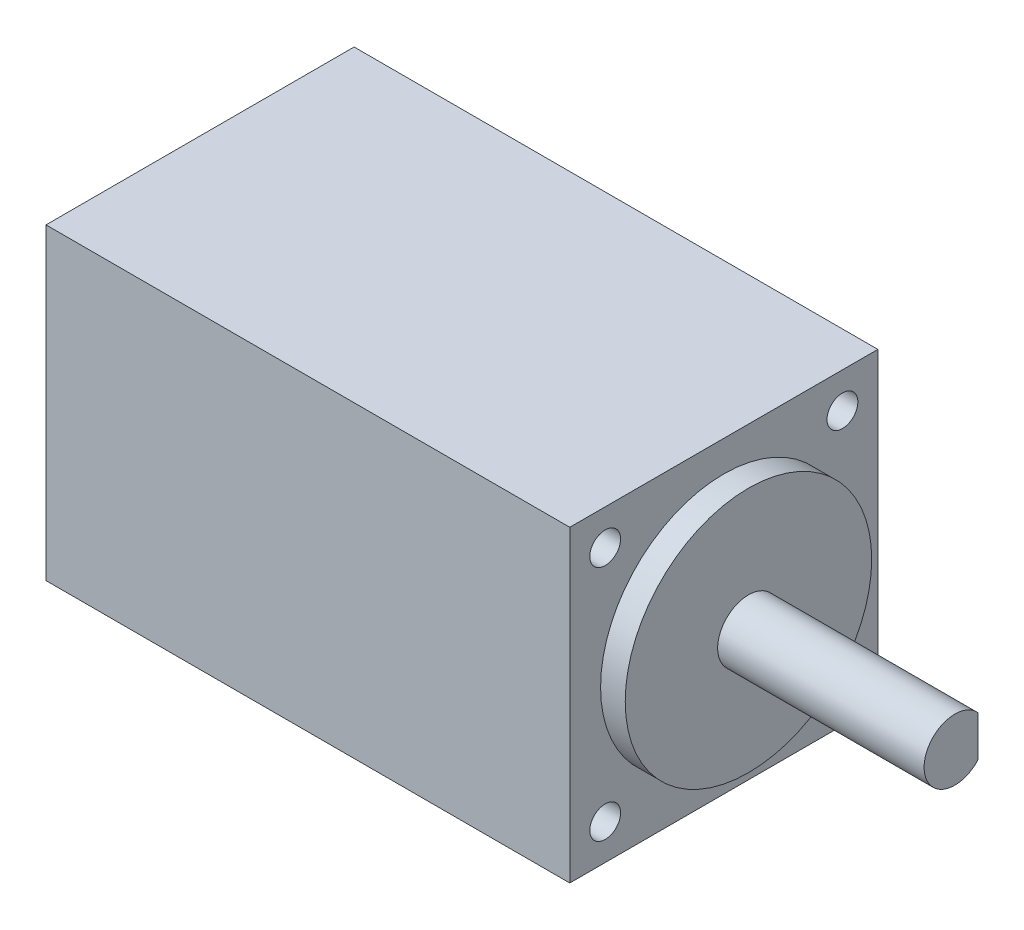
from build123d import *

# Parameters (mm, degrees)
SKETCH_1_W          = 20
SKETCH_1_H          = 20
SKETCH_1_R          = 1
EXTRUDE_2_DEPTH     = 34
SKETCH_2_R          = 8
EXTRUDE_3_DEPTH     = 1.6
SKETCH_3_R          = 2
EXTRUDE_4_DEPTH     = 13.4
CUT_EXTRUDE_START   = -9
CUT_EXTRUDE_1_DEPTH = 9


with BuildPart() as part:
    # 草图1 → 凸台-拉伸2 (new body)
    with BuildSketch(Plane(origin=(0, 0, 0), x_dir=(0, 0, -1), z_dir=(1, 0, 0))):
        with Locations((10, 10)):
            Rectangle(SKETCH_1_W, SKETCH_1_H)
        with Locations((2.3, 2.3)):
            Circle(SKETCH_1_R, mode=Mode.SUBTRACT)
        with Locations((2.3, 17.7)):
            Circle(SKETCH_1_R, mode=Mode.SUBTRACT)
        with Locations((17.7, 17.7)):
            Circle(SKETCH_1_R, mode=Mode.SUBTRACT)
        with Locations((17.7, 2.298566716)):
            Circle(SKETCH_1_R, mode=Mode.SUBTRACT)
    extrude(amount=EXTRUDE_2_DEPTH)

    # 草图2 → 凸台-拉伸3 (add)
    with BuildSketch(Plane(origin=(34, 0, 0), x_dir=(0, 0, -1), z_dir=(1, 0, 0))):
        with Locations((10, 10)):
            Circle(SKETCH_2_R)
    extrude(amount=EXTRUDE_3_DEPTH)

    # 草图3 → 凸台-拉伸4 (add)
    with BuildSketch(Plane(origin=(35.6, 0, 0), x_dir=(0, 0, -1), z_dir=(1, 0, 0))):
        with Locations((10, 10)):
            Circle(SKETCH_3_R)
    extrude(amount=EXTRUDE_4_DEPTH)

    # 草图4 → 切除-拉伸1 (cut)
    with BuildSketch(Plane(origin=(49, 0, 0), x_dir=(0, 0, -1), z_dir=(1, 0, 0)).offset(CUT_EXTRUDE_START)):
        with BuildLine():
            Line((11.5, 11.322875656), (11.5, 10))
            Line((11.5, 10), (11.5, 8.677124344))
            ThreePointArc((11.5, 8.677124344), (11.870828693, 9.292893219), (12, 10))
            ThreePointArc((12, 10), (11.870828693, 10.707106781), (11.5, 11.322875656))
        make_face()
    extrude(amount=CUT_EXTRUDE_1_DEPTH, mode=Mode.SUBTRACT)


solid = part.part
